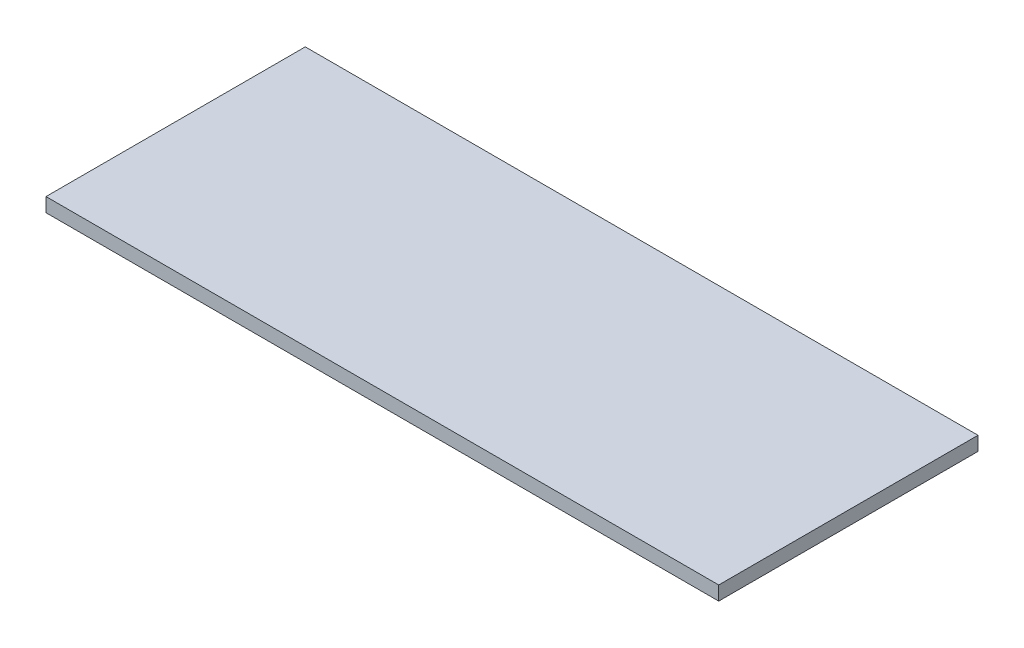
from build123d import *

# Parameters (mm, degrees)
SKETCH1_W           = 609.6
SKETCH1_H           = 234.95
BOSS_EXTRUDE1_DEPTH = 12.7


with BuildPart() as part:
    # Sketch1 → Boss-Extrude1 (new body)
    with BuildSketch(Plane(origin=(0, 0, 0), x_dir=(1, 0, 0), z_dir=(0, 1, 0))):
        with Locations((0, -117.475)):
            Rectangle(SKETCH1_W, SKETCH1_H)
    extrude(amount=BOSS_EXTRUDE1_DEPTH)


solid = part.part
